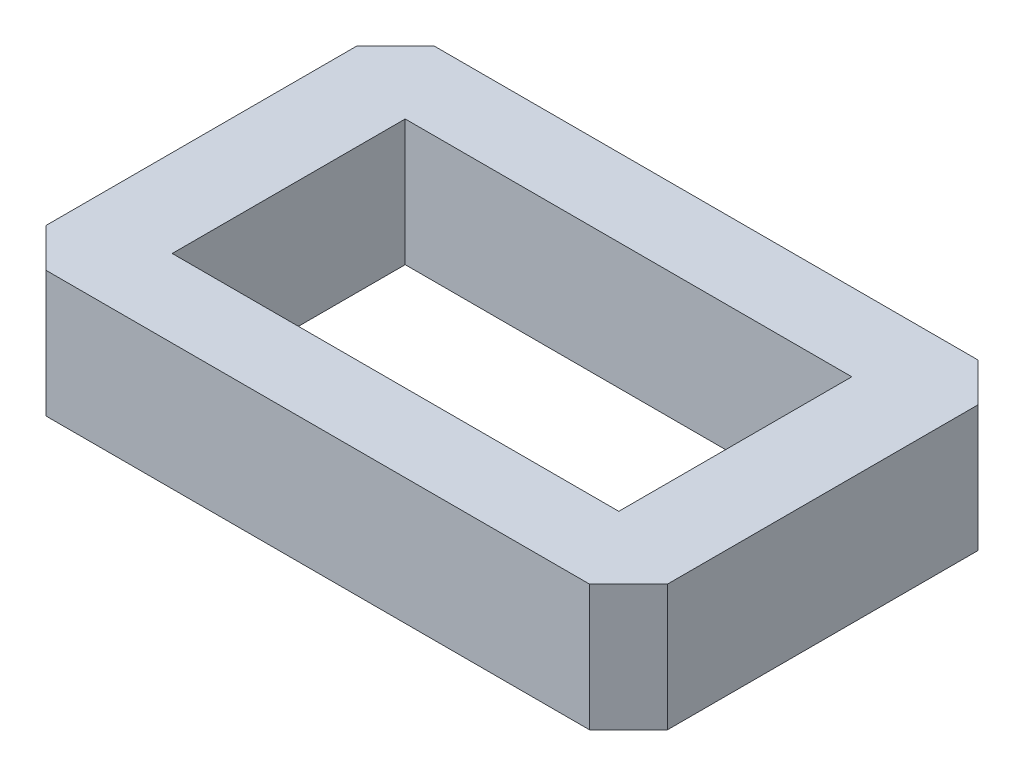
from build123d import *

# Parameters (mm, degrees)
SKETCH1_W           = 32
SKETCH1_H           = 20
BOSS_EXTRUDE1_DEPTH = 6.5
SKETCH2_W           = 23
SKETCH2_H           = 12
CUT_EXTRUDE1_DEPTH  = 20.956202043
CHAMFER1_SIZE       = 2


with BuildPart() as part:
    # Sketch1 → Boss-Extrude1 (new body)
    with BuildSketch(Plane(origin=(0, 0, 0), x_dir=(1, 0, 0), z_dir=(0, 1, 0))):
        Rectangle(SKETCH1_W, SKETCH1_H)
    extrude(amount=BOSS_EXTRUDE1_DEPTH)

    # Sketch2 → Cut-Extrude1 (cut, through all)
    with BuildSketch(Plane(origin=(0, 6.5, 0), x_dir=(1, 0, 0), z_dir=(0, 1, 0))):
        Rectangle(SKETCH2_W, SKETCH2_H)
    extrude(amount=-CUT_EXTRUDE1_DEPTH, mode=Mode.SUBTRACT)

    # Chamfer1
    chamfer1_edges = [part.edges().sort_by_distance(p)[0] for p in [
        (16, 3.25, 10),
        (-16, 3.25, 10),
        (-16, 3.25, -10),
        (16, 3.25, -10),
    ]]
    chamfer(chamfer1_edges, length=CHAMFER1_SIZE)


solid = part.part
